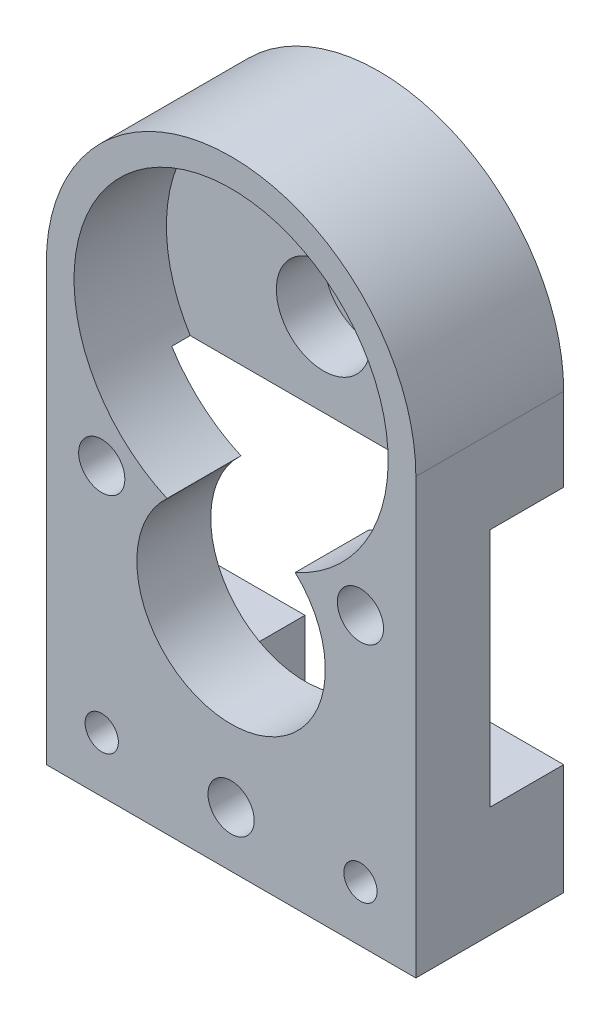
from build123d import *

# Parameters (mm, degrees)
SKETCH_1_R          = 1.25
EXTRUDE_1_DEPTH     = 4
EXTRUDE_START       = -8
EXTRUDE_2_DEPTH     = 8
EXTRUDE_START_2     = -3
EXTRUDE_3_DEPTH     = 3
CUT_EXTRUDE_START   = -4
SKETCH_1_5_R        = 2
CUT_EXTRUDE_1_DEPTH = 6
SKETCH_4_W          = 20
SKETCH_4_H          = 17.5
CUT_EXTRUDE_2_DEPTH = 4
EXTRUDE_START_3     = -4
SKETCH_5_W          = 20
SKETCH_5_H          = 6
EXTRUDE_4_DEPTH     = 8
SKETCH_6_W          = 8
SKETCH_6_H          = 6
SKETCH_6_R          = 2
SKETCH_6_R_2        = 1.25
CUT_EXTRUDE_3_DEPTH = 4
SKETCH_6_3_R        = 1.25
CUT_EXTRUDE_4_DEPTH = 26.024987512
SKETCH_6_4_R        = 2
CUT_EXTRUDE_5_DEPTH = 6
SKETCH_7_R          = 0.9
CUT_EXTRUDE_6_DEPTH = 26.024987512
SKETCH_8_W          = 20
SKETCH_8_H          = 4.5
EXTRUDE_5_DEPTH     = 4
SKETCH_9_R          = 8.5
CUT_EXTRUDE_7_DEPTH = 1
SKETCH_10_R         = 2.55
CUT_EXTRUDE_8_DEPTH = 2.6


with BuildPart() as part:
    # 草图1 → 凸台-拉伸1 (new, symmetric)
    with BuildSketch(Plane.XY):
        with BuildLine():
            Line((-10, 6), (-10, -6))
            Line((-10, -6), (10, -6))
            Line((10, -6), (10, 6))
            Line((10, 6), (6.480740698, 6))
            ThreePointArc((6.480740698, 6), (5.10105555, 4.70079179), (3.467802184, 3.739565217))
            ThreePointArc((3.467802184, 3.739565217), (0, -5.1), (-3.467802184, 3.739565217))
            ThreePointArc((-3.467802184, 3.739565217), (-5.10105555, 4.70079179), (-6.480740698, 6))
            Line((-6.480740698, 6), (-10, 6))
        make_face()
        with Locations((-7, 3.5)):
            Circle(SKETCH_1_R, mode=Mode.SUBTRACT)
        with Locations((7, 3.5)):
            Circle(SKETCH_1_R, mode=Mode.SUBTRACT)
    extrude(amount=EXTRUDE_1_DEPTH, both=True)

    # 草图2 → 凸台-拉伸2 (add)
    with BuildSketch(Plane(origin=(0, 0, -4), x_dir=(-1, 0, 0), z_dir=(0, 0, -1)).offset(EXTRUDE_START)):
        with BuildLine():
            Line((6.480740698, 6), (10, 6))
            Line((10, 6), (10, 11.5))
            ThreePointArc((10, 11.5), (0, 21.5), (-10, 11.5))
            Line((-10, 11.5), (-10, 6))
            Line((-10, 6), (-6.480740698, 6))
            ThreePointArc((-6.480740698, 6), (0, 20), (6.480740698, 6))
        make_face()
    extrude(amount=EXTRUDE_2_DEPTH)

    # 草图2<4> → 凸台-拉伸3 (add)
    with BuildSketch(Plane(origin=(0, 0, -4), x_dir=(-1, 0, 0), z_dir=(0, 0, -1)).offset(EXTRUDE_START_2)):
        with BuildLine():
            Line((-6.480740698, 6), (6.480740698, 6))
            ThreePointArc((6.480740698, 6), (7.979232292, 8.570520177), (8.5, 11.5))
            ThreePointArc((8.5, 11.5), (-2.929479823, 19.479232292), (-6.480740698, 6))
        make_face()
    extrude(amount=EXTRUDE_3_DEPTH)

    # 草图1<5> → 切除-拉伸1 (cut)
    with BuildSketch(Plane.XY.offset(CUT_EXTRUDE_START)):
        with Locations((-7, 3.5)):
            Circle(SKETCH_1_5_R)
        with Locations((7, 3.5)):
            Circle(SKETCH_1_5_R)
    extrude(amount=CUT_EXTRUDE_1_DEPTH, mode=Mode.SUBTRACT)

    # 草图4 → 切除-拉伸2 (cut)
    with BuildSketch(Plane(origin=(0, 0, -4), x_dir=(-1, 0, 0), z_dir=(0, 0, -1))):
        with Locations((0, 2.75)):
            Rectangle(SKETCH_4_W, SKETCH_4_H)
    extrude(amount=-CUT_EXTRUDE_2_DEPTH, mode=Mode.SUBTRACT)

    # 草图5 → 凸台-拉伸4 (add)
    with BuildSketch(Plane(origin=(0, 0, 0), x_dir=(-1, 0, 0), z_dir=(0, 0, -1)).offset(EXTRUDE_START_3)):
        with Locations((0, -9)):
            Rectangle(SKETCH_5_W, SKETCH_5_H)
    extrude(amount=EXTRUDE_4_DEPTH)

    # 草图6 → 切除-拉伸3 (cut)
    # profile 1 of 3: a face of its own
    with BuildSketch(Plane(origin=(0, 0, -4), x_dir=(-1, 0, 0), z_dir=(0, 0, -1))):
        with Locations((0, -9)):
            Rectangle(SKETCH_6_W, SKETCH_6_H)
        with Locations((0, -9)):
            Circle(SKETCH_6_R, mode=Mode.SUBTRACT)
    # profile 2 of 3: a face of its own
    with BuildSketch(Plane(origin=(0, 0, -4), x_dir=(-1, 0, 0), z_dir=(0, 0, -1))):
        with Locations((0, -9)):
            Circle(SKETCH_6_R)
        with Locations((0, -9)):
            Circle(SKETCH_6_R_2, mode=Mode.SUBTRACT)
    # profile 3 of 3: a face of its own
    with BuildSketch(Plane(origin=(0, 0, -4), x_dir=(-1, 0, 0), z_dir=(0, 0, -1))):
        with Locations((0, -9)):
            Circle(SKETCH_6_R_2)
    extrude(amount=-CUT_EXTRUDE_3_DEPTH, mode=Mode.SUBTRACT)

    # 草图6<3> → 切除-拉伸4 (cut, through all)
    with BuildSketch(Plane(origin=(0, 0, -4), x_dir=(-1, 0, 0), z_dir=(0, 0, -1))):
        with Locations((0, -9)):
            Circle(SKETCH_6_3_R)
    extrude(amount=-CUT_EXTRUDE_4_DEPTH, mode=Mode.SUBTRACT)

    # 草图6<4> → 切除-拉伸5 (cut)
    with BuildSketch(Plane(origin=(0, 0, -4), x_dir=(-1, 0, 0), z_dir=(0, 0, -1))):
        with Locations(Location((0, -9, 0), (0, 0, 180))):
            Circle(SKETCH_6_4_R)
    extrude(amount=-CUT_EXTRUDE_5_DEPTH, mode=Mode.SUBTRACT)

    # 草图7 → 切除-拉伸6 (cut, through all)
    with BuildSketch(Plane(origin=(0, 0, -4), x_dir=(-1, 0, 0), z_dir=(0, 0, -1))):
        with Locations((7, -9)):
            Circle(SKETCH_7_R)
        with Locations((-7, -9)):
            Circle(SKETCH_7_R)
        with Locations((0, 16)):
            Circle(SKETCH_7_R)
    extrude(amount=-CUT_EXTRUDE_6_DEPTH, mode=Mode.SUBTRACT)

    # 草图8 → 凸台-拉伸5 (add)
    with BuildSketch(Plane(origin=(0, 0, 0), x_dir=(-1, 0, 0), z_dir=(0, 0, -1))):
        with Locations((0, 9.25)):
            Rectangle(SKETCH_8_W, SKETCH_8_H)
    extrude(amount=EXTRUDE_5_DEPTH)

    # 草图9 → 切除-拉伸7 (cut)
    with BuildSketch(Plane.XY):
        with Locations((0, 11.5)):
            Circle(SKETCH_9_R)
    extrude(amount=-CUT_EXTRUDE_7_DEPTH, mode=Mode.SUBTRACT)

    # 草图10 → 切除-拉伸8 (cut)
    with BuildSketch(Plane.XY.offset(-1)):
        with Locations((0, 11.5)):
            Circle(SKETCH_10_R)
    extrude(amount=-CUT_EXTRUDE_8_DEPTH, mode=Mode.SUBTRACT)


solid = part.part
